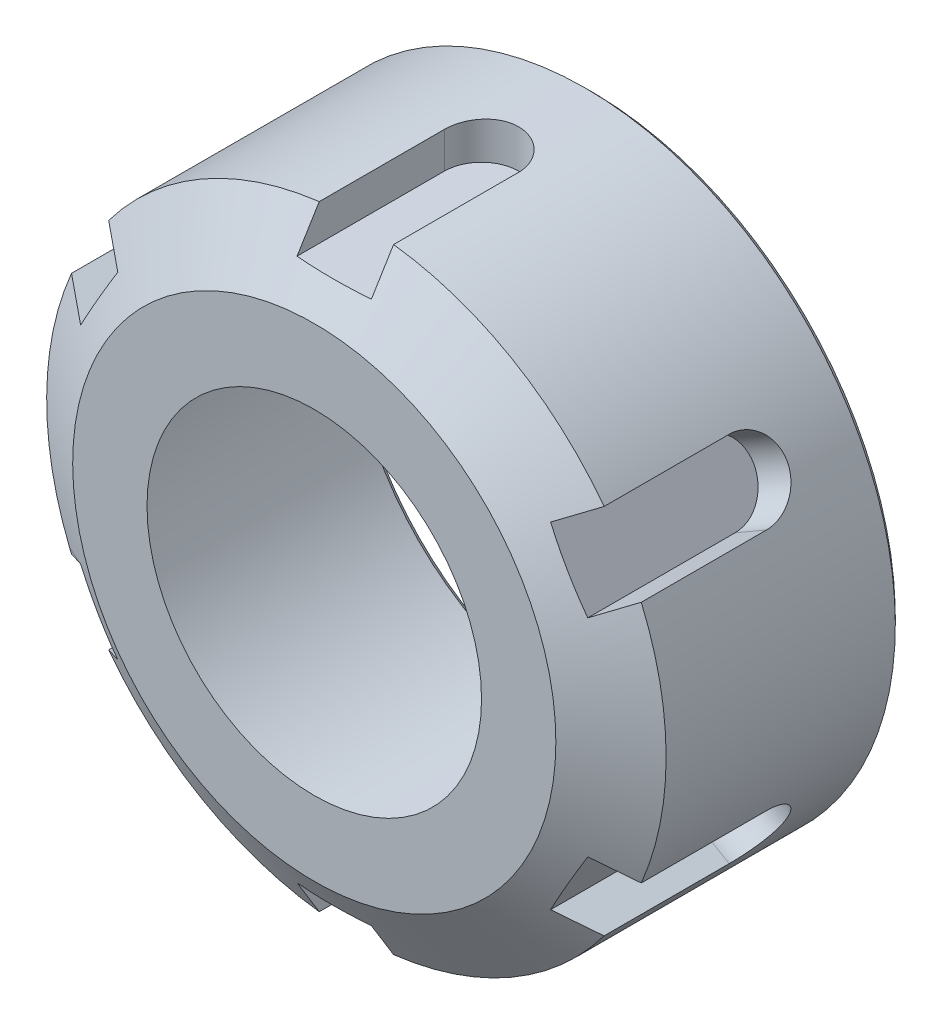
from build123d import *

# Parameters (mm, degrees)
SKETCH_2_W               = 6
SKETCH_2_H               = 4.457533552
CUT_EXTRUDE_1_DEPTH      = 13.5
SKETCH_3_W               = 3
SKETCH_3_H               = 5
PATTERN_CIRCULAR_1_COUNT = 6
CHAMFER_1_SIZE           = 0.5


with BuildPart() as part:
    # Эскиз1 → Повернуть1 (revolve)
    with BuildSketch(Plane(origin=(0, 0, 0), x_dir=(1, 0, 0), z_dir=(0, 1, 0))):
        Polygon((19, 22.4), (25, 22.4), (25, 3.4), (19.5, 0), (13.5, 0), (19, 3.4), align=None)
    revolve(axis=Axis((0, 0, 0), (0, 0, -1)))

    # Эскиз2 → Вырез-Вытянуть1 (cut)
    with BuildSketch(Plane.XY):
        with Locations((0, 24.128766776)):
            Rectangle(SKETCH_2_W, SKETCH_2_H)
    cut_extrude_1 = extrude(amount=-CUT_EXTRUDE_1_DEPTH, mode=Mode.SUBTRACT)

    # Эскиз3 → Вырез-Повернуть1 (revolve, cut)
    with BuildSketch(Plane.XY.offset(-13.5)):
        with Locations((1.5, 24.4)):
            Rectangle(SKETCH_3_W, SKETCH_3_H)
    cut_revolve_1 = revolve(axis=Axis((0, 26.9, -13.5), (0, -1, 0)), mode=Mode.SUBTRACT)

    # Круговой массив1: Вырез-Вытянуть1, Вырез-Повернуть1 ×6 about axis
    pattern_circular_1_axis = Axis((0, 0, 0), (0, 0, 1))
    add([cut_extrude_1.rotate(pattern_circular_1_axis, i * 360 / PATTERN_CIRCULAR_1_COUNT) for i in range(1, PATTERN_CIRCULAR_1_COUNT)], mode=Mode.SUBTRACT)
    add([cut_revolve_1.rotate(pattern_circular_1_axis, i * 360 / PATTERN_CIRCULAR_1_COUNT) for i in range(1, PATTERN_CIRCULAR_1_COUNT)], mode=Mode.SUBTRACT)

    # Фаска1
    chamfer_1_edges = [part.edges().sort_by_distance(p)[0] for p in [
        (-19, 0, -22.4),
        (-25, 0, -22.4),
    ]]
    chamfer(chamfer_1_edges, length=CHAMFER_1_SIZE)


solid = part.part
